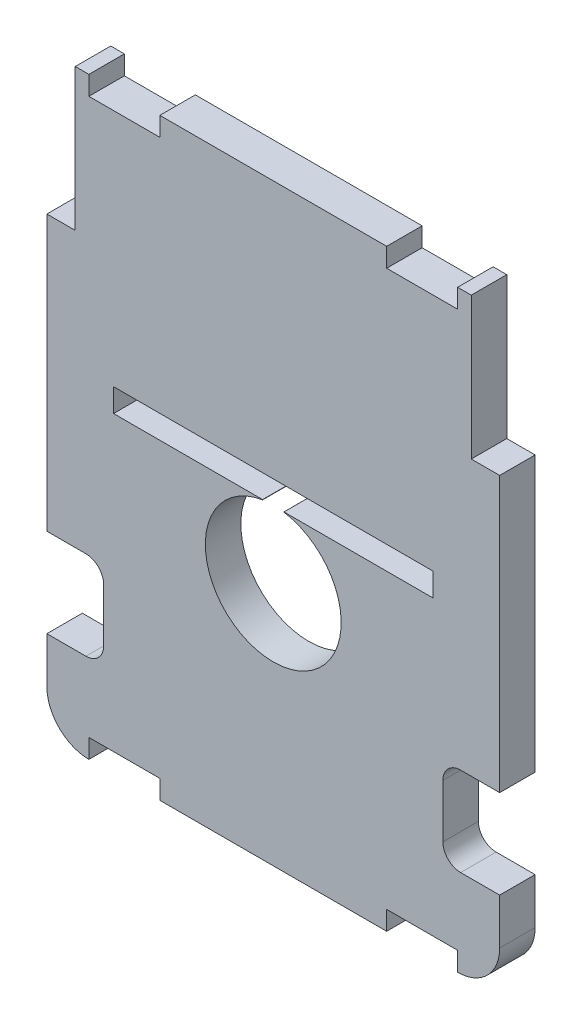
from build123d import *

# Parameters (mm, degrees)
BOSS_EXTRUDE1_DEPTH = 6.35


with BuildPart() as part:
    # Sketch1 → Boss-Extrude1 (new body)
    with BuildSketch(Plane.XY):
        with BuildLine():
            Line((8823.036740753, 3168.83754785), (8823.036740753, 3119.67584785))
            Line((8823.036740753, 3119.67584785), (8816.051740753, 3119.67584785))
            ThreePointArc((8816.051740753, 3119.67584785), (8813.806676722, 3118.74591188), (8812.876740753, 3116.50084785))
            Line((8812.876740753, 3116.50084785), (8812.876740753, 3106.97584785))
            ThreePointArc((8812.876740753, 3106.97584785), (8813.806676722, 3104.73078382), (8816.051740753, 3103.80084785))
            Line((8816.051740753, 3103.80084785), (8823.036740753, 3103.80084785))
            Line((8823.036740753, 3103.80084785), (8823.036740753, 3095.59664785))
            ThreePointArc((8823.036740753, 3095.59664785), (8820.834652376, 3090.280336226), (8815.518340753, 3088.07824785))
            Line((8815.518340753, 3088.07824785), (8815.518340753, 3091.48184785))
            Line((8815.518340753, 3091.48184785), (8802.818340753, 3091.48184785))
            Line((8802.818340753, 3091.48184785), (8802.818340753, 3088.07824785))
            Line((8802.818340753, 3088.07824785), (8762.229140753, 3088.07824785))
            Line((8762.229140753, 3088.07824785), (8762.229140753, 3091.48184785))
            Line((8762.229140753, 3091.48184785), (8749.529140753, 3091.48184785))
            Line((8749.529140753, 3091.48184785), (8749.529140753, 3088.07824785))
            ThreePointArc((8749.529140753, 3088.07824785), (8744.212829129, 3090.280336226), (8742.010740753, 3095.59664785))
            Line((8742.010740753, 3095.59664785), (8742.010740753, 3103.80084785))
            Line((8742.010740753, 3103.80084785), (8748.995740753, 3103.80084785))
            ThreePointArc((8748.995740753, 3103.80084785), (8751.240804783, 3104.73078382), (8752.170740753, 3106.97584785))
            Line((8752.170740753, 3106.97584785), (8752.170740753, 3116.50084785))
            ThreePointArc((8752.170740753, 3116.50084785), (8751.240804783, 3118.74591188), (8748.995740753, 3119.67584785))
            Line((8748.995740753, 3119.67584785), (8742.010740753, 3119.67584785))
            Line((8742.010740753, 3119.67584785), (8742.010740753, 3168.83754785))
            Line((8742.010740753, 3168.83754785), (8747.090740753, 3168.83754785))
            Line((8747.090740753, 3168.83754785), (8747.090740753, 3194.23754785))
            Line((8747.090740753, 3194.23754785), (8749.529140753, 3194.23754785))
            Line((8749.529140753, 3194.23754785), (8749.529140753, 3190.83394785))
            Line((8749.529140753, 3190.83394785), (8762.229140753, 3190.83394785))
            Line((8762.229140753, 3190.83394785), (8762.229140753, 3194.23754785))
            Line((8762.229140753, 3194.23754785), (8802.818340753, 3194.23754785))
            Line((8802.818340753, 3194.23754785), (8802.818340753, 3190.83394785))
            Line((8802.818340753, 3190.83394785), (8815.518340753, 3190.83394785))
            Line((8815.518340753, 3190.83394785), (8815.518340753, 3194.23754785))
            Line((8815.518340753, 3194.23754785), (8817.956740753, 3194.23754785))
            Line((8817.956740753, 3194.23754785), (8817.956740753, 3168.83754785))
            Line((8817.956740753, 3168.83754785), (8823.036740753, 3168.83754785))
        make_face()
        with BuildLine():
            Line((8780.603057309, 3143.88204785), (8753.948740753, 3143.88204785))
            Line((8753.948740753, 3143.88204785), (8753.948740753, 3148.04764785))
            Line((8753.948740753, 3148.04764785), (8811.098740753, 3148.04764785))
            Line((8811.098740753, 3148.04764785), (8811.098740753, 3143.88204785))
            Line((8811.098740753, 3143.88204785), (8784.444424196, 3143.88204785))
            ThreePointArc((8784.444424196, 3143.88204785), (8784.419103776, 3143.858656943), (8784.440418599, 3143.831565681))
            ThreePointArc((8784.440418599, 3143.831565681), (8782.523740753, 3119.67584785), (8780.607062906, 3143.831565681))
            ThreePointArc((8780.607062906, 3143.831565681), (8780.628377729, 3143.858656943), (8780.603057309, 3143.88204785))
        make_face(mode=Mode.SUBTRACT)
    extrude(amount=BOSS_EXTRUDE1_DEPTH)


solid = part.part
